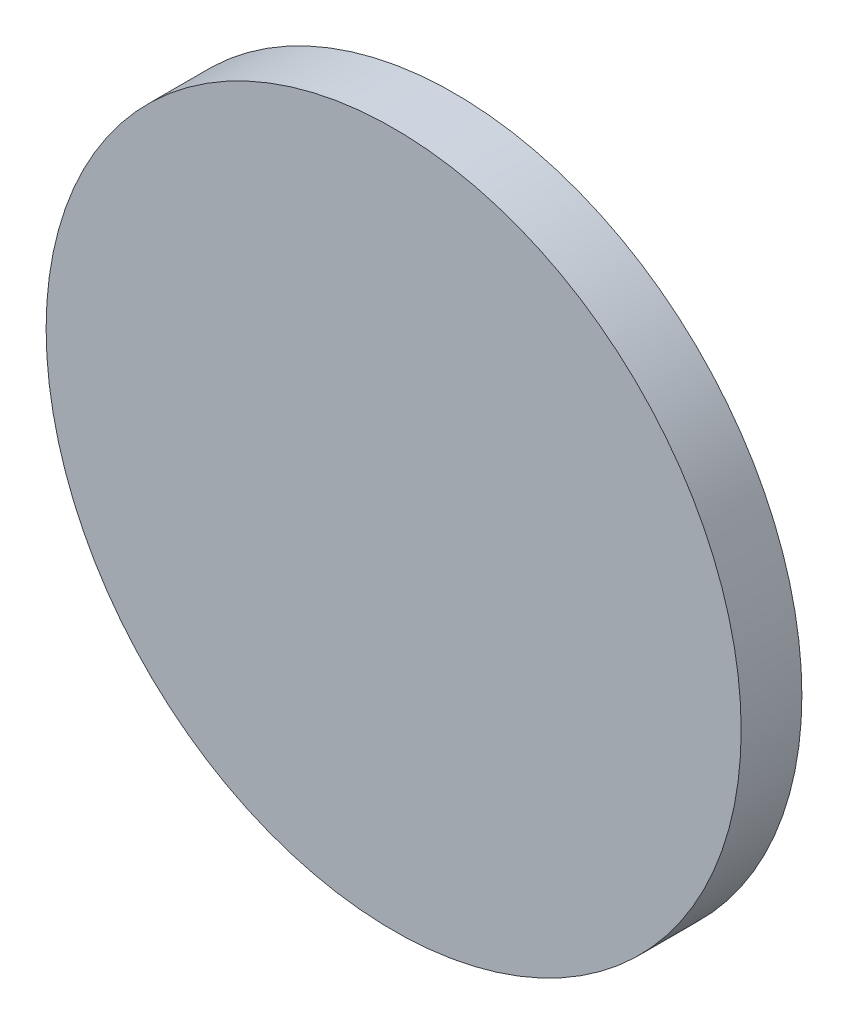
from build123d import *

# Parameters (mm, degrees)
SKETCH2_R           = 11.45
BOSS_EXTRUDE1_DEPTH = 2


with BuildPart() as part:
    # Sketch2 → Boss-Extrude1 (new body)
    with BuildSketch(Plane.XY):
        Circle(SKETCH2_R)
    extrude(amount=BOSS_EXTRUDE1_DEPTH)


solid = part.part
